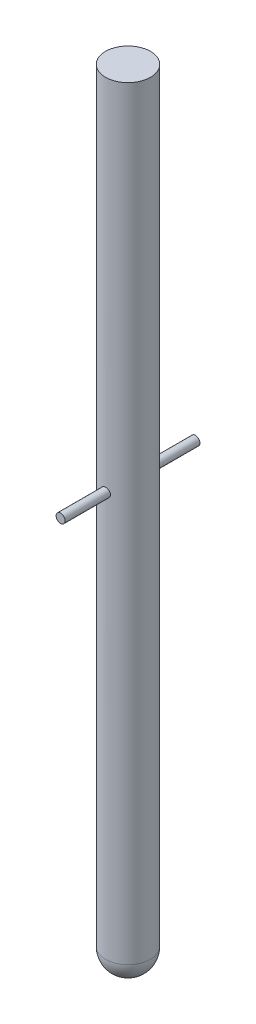
from build123d import *

# Parameters (mm, degrees)
SZKIC2_R                         = 5
DODANIE_WYCI_GNI_CIE1_DEPTH      = 175
DODANIE_WYCI_GNI_CIE2_DEPTH      = 15
DODANIE_WYCI_GNI_CIE2_DEPTH_BACK = 15
SZKIC3_R                         = 1
ZAOKR_GLENIE1_R                  = 5


with BuildPart() as part:
    # Szkic2 → Dodanie-wyciągnięcie1 (new body)
    with BuildSketch(Plane(origin=(0, 0, 0), x_dir=(1, 0, 0), z_dir=(0, 1, 0))):
        Circle(SZKIC2_R)
    extrude(amount=DODANIE_WYCI_GNI_CIE1_DEPTH)

    # Szkic3 → Dodanie-wyciągnięcie2 (add, two sides: drawn at the far end of the back side and taken through both)
    with BuildSketch(Plane.XY.offset(-DODANIE_WYCI_GNI_CIE2_DEPTH_BACK)):
        with Locations((0, 95)):
            Circle(SZKIC3_R)
    extrude(amount=DODANIE_WYCI_GNI_CIE2_DEPTH + DODANIE_WYCI_GNI_CIE2_DEPTH_BACK)

    # Zaokrąglenie1
    zaokr_glenie1_edges = [part.edges().sort_by_distance(p)[0] for p in [
        (-5, 0, 0),
    ]]
    fillet(zaokr_glenie1_edges, radius=ZAOKR_GLENIE1_R)


solid = part.part
